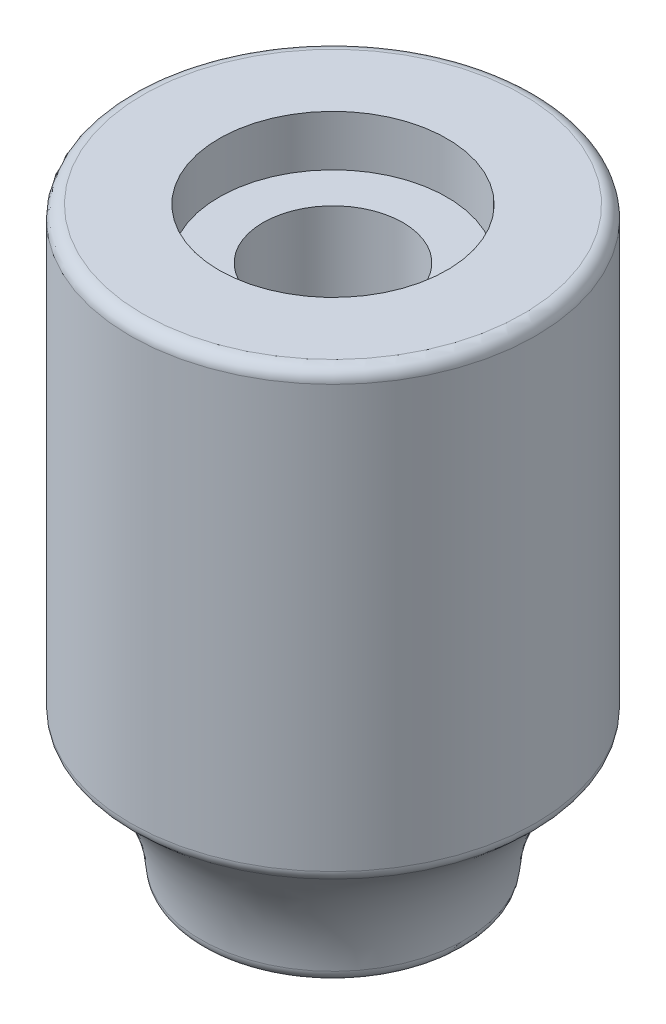
from build123d import *

# Parameters (mm, degrees)
SKETCH1_R               = 25.4
BOSS_EXTRUDE1_DEPTH     = 73.025
SKETCH2_R               = 14.2875
CUT_EXTRUDE1_DEPTH      = 6.35
CUT_EXTRUDE2_START      = -6.35
SKETCH3_R               = 14.2875
CUT_EXTRUDE2_DEPTH      = 6.35
CUT_EXTRUDE3_DEPTH      = 76.735563806
CUT_EXTRUDE3_DEPTH_BACK = 76.735563806
SKETCH4_R               = 8.763
SKETCH5_R               = 25.4
SKETCH5_R_2             = 16.51
CUT_EXTRUDE5_DEPTH      = 17.78
FILLET8_R               = 1.5875


with BuildPart() as part:
    # Sketch1 → Boss-Extrude1 (new body)
    with BuildSketch(Plane(origin=(0, 0, 0), x_dir=(1, 0, 0), z_dir=(0, 1, 0))):
        with Locations(Location((0, 0, 0), (0, 0, 270))):
            Circle(SKETCH1_R)
    extrude(amount=BOSS_EXTRUDE1_DEPTH)

    # Sketch2 → Cut-Extrude1 (cut)
    with BuildSketch(Plane(origin=(0, 73.025, 0), x_dir=(1, 0, 0), z_dir=(0, 1, 0))):
        with Locations(Location((0, 0, 0), (0, 0, 270))):
            Circle(SKETCH2_R)
    extrude(amount=-CUT_EXTRUDE1_DEPTH, mode=Mode.SUBTRACT)

    # Sketch3 → Cut-Extrude2 (cut)
    with BuildSketch(Plane.XZ.offset(CUT_EXTRUDE2_START)):
        with Locations(Location((0, 0, 0), (0, 0, 90))):
            Circle(SKETCH3_R)
    extrude(amount=CUT_EXTRUDE2_DEPTH, mode=Mode.SUBTRACT)

    # Sketch4 → Cut-Extrude3 (cut, two sides: drawn at the far end of the back side and taken through both)
    with BuildSketch(Plane.XZ.offset(-6.35).offset(-CUT_EXTRUDE3_DEPTH_BACK)):
        with Locations(Location((0, 0, 0), (0, 0, 270))):
            Circle(SKETCH4_R)
    extrude(amount=CUT_EXTRUDE3_DEPTH + CUT_EXTRUDE3_DEPTH_BACK, mode=Mode.SUBTRACT)

    # Sketch5 → Cut-Extrude5 (cut)
    with BuildSketch(Plane(origin=(0, 0, 0), x_dir=(-1, 0, 0), z_dir=(0, -1, 0))):
        with Locations(Location((0, 0, 0), (0, 0, 90))):
            Circle(SKETCH5_R)
        with Locations(Location((0, 0, 0), (0, 0, 90))):
            Circle(SKETCH5_R_2, mode=Mode.SUBTRACT)
    extrude(amount=-CUT_EXTRUDE5_DEPTH, mode=Mode.SUBTRACT)

    # Sketch10 → Revolve3 (revolve)
    with BuildSketch(Plane.XY, mode=Mode.PRIVATE) as revolve3_sk:
        with BuildLine():
            Line((-25.4, 17.78), (-16.51, 17.78))
            Line((-16.51, 17.78), (-16.51, 0))
            ThreePointArc((-16.51, 0), (-18.85635568, 9.93932216), (-25.4, 17.78))
        make_face()
    revolve(revolve3_sk.sketch.rotate(Axis((0, 0, 0), (0, -1, 0)), 90), axis=Axis((0, 0, 0), (0, -1, 0)))

    # Fillet8
    fillet8_edges = [part.edges().sort_by_distance(p)[0] for p in [
        (25.4, 17.78, 0),
        (0, 0, 16.51),
        (0, 73.025, -25.4),
    ]]
    fillet(fillet8_edges, radius=FILLET8_R)


solid = part.part
